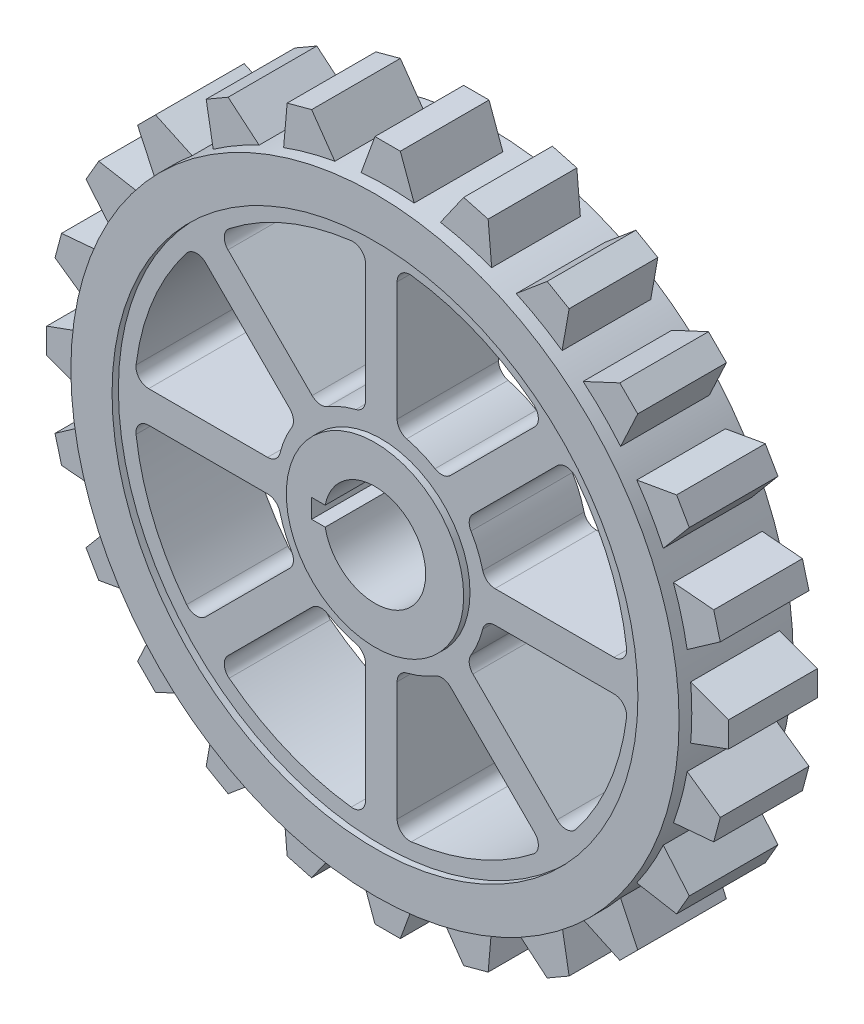
from build123d import *
from build123d.topology import SkipClean

# Parameters (mm, degrees)
SKETCH2_R           = 41.5
BOSS_EXTRUDE2_DEPTH = 18
BOSS_EXTRUDE3_START = 9
SKETCH4_R           = 41.5
BOSS_EXTRUDE3_DEPTH = 8
SKETCH5_R           = 14
BOSS_EXTRUDE4_DEPTH = 18
CUT_EXTRUDE2_START  = 16
CUT_EXTRUDE2_DEPTH  = 2
CUT_EXTRUDE3_DEPTH  = 2
CUT_EXTRUDE4_DEPTH  = 18
CUT_EXTRUDE5_DEPTH  = 18


with BuildPart() as part:
    # Sketch2 → Boss-Extrude2 (new body)
    with BuildSketch(Plane(origin=(0, 0, 0), x_dir=(0, 1, 0), z_dir=(0, 0, 1))):
        with BuildLine():
            Line((-4.183821406, 47.817315258), (-2, 53.817315258))
            Line((-2, 53.817315258), (2, 53.817315258))
            Line((2, 53.817315258), (4.183821406, 47.817315258))
            ThreePointArc((4.183821406, 47.817315258), (6.265257227, 47.589353346), (8.334770726, 47.270832412))
            Line((8.334770726, 47.270832412), (11.997094492, 52.501172799))
            Line((11.997094492, 52.501172799), (15.860797798, 51.465896619))
            Line((15.860797798, 51.465896619), (16.417293023, 45.10512709))
            ThreePointArc((16.417293023, 45.10512709), (18.368804754, 44.346217561), (20.285362007, 43.502920457))
            Line((20.285362007, 43.502920457), (25.176606821, 47.607162177))
            Line((25.176606821, 47.607162177), (28.640708436, 45.607162177))
            Line((28.640708436, 45.607162177), (27.531953251, 39.319099051))
            ThreePointArc((27.531953251, 39.319099051), (29.220548592, 38.080960334), (30.85353939, 36.770356364))
            Line((30.85353939, 36.770356364), (36.640375002, 39.468802126))
            Line((36.640375002, 39.468802126), (39.468802126, 36.640375002))
            Line((39.468802126, 36.640375002), (36.770356364, 30.85353939))
            ThreePointArc((36.770356364, 30.85353939), (38.080960334, 29.220548592), (39.319099051, 27.531953251))
            Line((39.319099051, 27.531953251), (45.607162177, 28.640708436))
            Line((45.607162177, 28.640708436), (47.607162177, 25.176606821))
            Line((47.607162177, 25.176606821), (43.502920457, 20.285362007))
            ThreePointArc((43.502920457, 20.285362007), (44.346217561, 18.368804754), (45.10512709, 16.417293023))
            Line((45.10512709, 16.417293023), (51.465896619, 15.860797798))
            Line((51.465896619, 15.860797798), (52.501172799, 11.997094492))
            Line((52.501172799, 11.997094492), (47.270832412, 8.334770726))
            ThreePointArc((47.270832412, 8.334770726), (47.589353346, 6.265257227), (47.817315258, 4.183821406))
            Line((47.817315258, 4.183821406), (53.817315258, 2))
            Line((53.817315258, 2), (53.817315258, -2))
            Line((53.817315258, -2), (47.817315258, -4.183821406))
            ThreePointArc((47.817315258, -4.183821406), (47.589353346, -6.265257227), (47.270832412, -8.334770726))
            Line((47.270832412, -8.334770726), (52.501172799, -11.997094492))
            Line((52.501172799, -11.997094492), (51.465896619, -15.860797798))
            Line((51.465896619, -15.860797798), (45.10512709, -16.417293023))
            ThreePointArc((45.10512709, -16.417293023), (44.346217561, -18.368804754), (43.502920457, -20.285362007))
            Line((43.502920457, -20.285362007), (47.607162177, -25.176606821))
            Line((47.607162177, -25.176606821), (45.607162177, -28.640708436))
            Line((45.607162177, -28.640708436), (39.319099051, -27.531953251))
            ThreePointArc((39.319099051, -27.531953251), (38.080960334, -29.220548592), (36.770356364, -30.85353939))
            Line((36.770356364, -30.85353939), (39.468802126, -36.640375002))
            Line((39.468802126, -36.640375002), (36.640375002, -39.468802126))
            Line((36.640375002, -39.468802126), (30.85353939, -36.770356364))
            ThreePointArc((30.85353939, -36.770356364), (29.220548592, -38.080960334), (27.531953251, -39.319099051))
            Line((27.531953251, -39.319099051), (28.640708436, -45.607162177))
            Line((28.640708436, -45.607162177), (25.176606821, -47.607162177))
            Line((25.176606821, -47.607162177), (20.285362007, -43.502920457))
            ThreePointArc((20.285362007, -43.502920457), (18.368804754, -44.346217561), (16.417293023, -45.10512709))
            Line((16.417293023, -45.10512709), (15.860797798, -51.465896619))
            Line((15.860797798, -51.465896619), (11.997094492, -52.501172799))
            Line((11.997094492, -52.501172799), (8.334770726, -47.270832412))
            ThreePointArc((8.334770726, -47.270832412), (6.265257227, -47.589353346), (4.183821406, -47.817315258))
            Line((4.183821406, -47.817315258), (2, -53.817315258))
            Line((2, -53.817315258), (-2, -53.817315258))
            Line((-2, -53.817315258), (-4.183821406, -47.817315258))
            ThreePointArc((-4.183821406, -47.817315258), (-6.265257227, -47.589353346), (-8.334770726, -47.270832412))
            Line((-8.334770726, -47.270832412), (-11.997094492, -52.501172799))
            Line((-11.997094492, -52.501172799), (-15.860797798, -51.465896619))
            Line((-15.860797798, -51.465896619), (-16.417293023, -45.10512709))
            ThreePointArc((-16.417293023, -45.10512709), (-18.368804754, -44.346217561), (-20.285362007, -43.502920457))
            Line((-20.285362007, -43.502920457), (-25.176606821, -47.607162177))
            Line((-25.176606821, -47.607162177), (-28.640708436, -45.607162177))
            Line((-28.640708436, -45.607162177), (-27.531953251, -39.319099051))
            ThreePointArc((-27.531953251, -39.319099051), (-29.220548592, -38.080960334), (-30.85353939, -36.770356364))
            Line((-30.85353939, -36.770356364), (-36.640375002, -39.468802126))
            Line((-36.640375002, -39.468802126), (-39.468802126, -36.640375002))
            Line((-39.468802126, -36.640375002), (-36.770356364, -30.85353939))
            ThreePointArc((-36.770356364, -30.85353939), (-38.080960334, -29.220548592), (-39.319099051, -27.531953251))
            Line((-39.319099051, -27.531953251), (-45.607162177, -28.640708436))
            Line((-45.607162177, -28.640708436), (-47.607162177, -25.176606821))
            Line((-47.607162177, -25.176606821), (-43.502920457, -20.285362007))
            ThreePointArc((-43.502920457, -20.285362007), (-44.346217561, -18.368804754), (-45.10512709, -16.417293023))
            Line((-45.10512709, -16.417293023), (-51.465896619, -15.860797798))
            Line((-51.465896619, -15.860797798), (-52.501172799, -11.997094492))
            Line((-52.501172799, -11.997094492), (-47.270832412, -8.334770726))
            ThreePointArc((-47.270832412, -8.334770726), (-47.589353346, -6.265257227), (-47.817315258, -4.183821406))
            Line((-47.817315258, -4.183821406), (-53.817315258, -2))
            Line((-53.817315258, -2), (-53.817315258, 2))
            Line((-53.817315258, 2), (-47.817315258, 4.183821406))
            ThreePointArc((-47.817315258, 4.183821406), (-47.589353346, 6.265257227), (-47.270832412, 8.334770726))
            Line((-47.270832412, 8.334770726), (-52.501172799, 11.997094492))
            Line((-52.501172799, 11.997094492), (-51.465896619, 15.860797798))
            Line((-51.465896619, 15.860797798), (-45.10512709, 16.417293023))
            ThreePointArc((-45.10512709, 16.417293023), (-44.346217561, 18.368804754), (-43.502920457, 20.285362007))
            Line((-43.502920457, 20.285362007), (-47.607162177, 25.176606821))
            Line((-47.607162177, 25.176606821), (-45.607162177, 28.640708436))
            Line((-45.607162177, 28.640708436), (-39.319099051, 27.531953251))
            ThreePointArc((-39.319099051, 27.531953251), (-38.080960334, 29.220548592), (-36.770356364, 30.85353939))
            Line((-36.770356364, 30.85353939), (-39.468802126, 36.640375002))
            Line((-39.468802126, 36.640375002), (-36.640375002, 39.468802126))
            Line((-36.640375002, 39.468802126), (-30.85353939, 36.770356364))
            ThreePointArc((-30.85353939, 36.770356364), (-29.220548592, 38.080960334), (-27.531953251, 39.319099051))
            Line((-27.531953251, 39.319099051), (-28.640708436, 45.607162177))
            Line((-28.640708436, 45.607162177), (-25.176606821, 47.607162177))
            Line((-25.176606821, 47.607162177), (-20.285362007, 43.502920457))
            ThreePointArc((-20.285362007, 43.502920457), (-18.368804754, 44.346217561), (-16.417293023, 45.10512709))
            Line((-16.417293023, 45.10512709), (-15.860797798, 51.465896619))
            Line((-15.860797798, 51.465896619), (-11.997094492, 52.501172799))
            Line((-11.997094492, 52.501172799), (-8.334770726, 47.270832412))
            ThreePointArc((-8.334770726, 47.270832412), (-6.265257227, 47.589353346), (-4.183821406, 47.817315258))
        make_face()
        with Locations(Location((0, 0, 0), (0, 0, 270))):
            Circle(SKETCH2_R, mode=Mode.SUBTRACT)
    extrude(amount=BOSS_EXTRUDE2_DEPTH)

    # Sketch4 → Boss-Extrude3 (add, symmetric)
    with BuildSketch(Plane(origin=(0, 0, 0), x_dir=(0, 1, 0), z_dir=(0, 0, 1)).offset(BOSS_EXTRUDE3_START)):
        with Locations(Location((0, 0, 0), (0, 0, 270))):
            Circle(SKETCH4_R)
    extrude(amount=BOSS_EXTRUDE3_DEPTH, both=True)

    # Sketch5 → Boss-Extrude4 (add)
    with BuildSketch(Plane(origin=(0, 0, 0), x_dir=(0, 1, 0), z_dir=(0, 0, 1))):
        with Locations(Location((0, 0, 0), (0, 0, 270))):
            Circle(SKETCH5_R)
    extrude(amount=BOSS_EXTRUDE4_DEPTH)

    # Sketch6 → Cut-Extrude2 (cut)
    with SkipClean():  # the faces are left unmerged after this step: merging them gives an invalid solid
        with BuildSketch(Plane(origin=(0, 0, 0), x_dir=(0, 1, 0), z_dir=(0, 0, 1)).offset(CUT_EXTRUDE2_START)):
            with BuildLine():
                Line((-4.183821406, 47.817315258), (-2, 53.817315258))
                Line((-2, 53.817315258), (2, 53.817315258))
                Line((2, 53.817315258), (4.183821406, 47.817315258))
                ThreePointArc((4.183821406, 47.817315258), (0, 48), (-4.183821406, 47.817315258))
            make_face()
            with BuildLine():
                Line((8.334770726, 47.270832412), (11.997094492, 52.501172799))
                Line((11.997094492, 52.501172799), (15.860797798, 51.465896619))
                Line((15.860797798, 51.465896619), (16.417293023, 45.10512709))
                ThreePointArc((16.417293023, 45.10512709), (12.423314165, 46.364439662), (8.334770726, 47.270832412))
            make_face()
            with BuildLine():
                Line((20.285362007, 43.502920457), (25.176606821, 47.607162177))
                Line((25.176606821, 47.607162177), (28.640708436, 45.607162177))
                Line((28.640708436, 45.607162177), (27.531953251, 39.319099051))
                ThreePointArc((27.531953251, 39.319099051), (24, 41.569219382), (20.285362007, 43.502920457))
            make_face()
            with BuildLine():
                Line((30.85353939, 36.770356364), (36.640375002, 39.468802126))
                Line((36.640375002, 39.468802126), (39.468802126, 36.640375002))
                Line((39.468802126, 36.640375002), (36.770356364, 30.85353939))
                ThreePointArc((36.770356364, 30.85353939), (33.941125497, 33.941125497), (30.85353939, 36.770356364))
            make_face()
            with BuildLine():
                Line((39.319099051, 27.531953251), (45.607162177, 28.640708436))
                Line((45.607162177, 28.640708436), (47.607162177, 25.176606821))
                Line((47.607162177, 25.176606821), (43.502920457, 20.285362007))
                ThreePointArc((43.502920457, 20.285362007), (41.569219382, 24), (39.319099051, 27.531953251))
            make_face()
            with BuildLine():
                Line((45.10512709, 16.417293023), (51.465896619, 15.860797798))
                Line((51.465896619, 15.860797798), (52.501172799, 11.997094492))
                Line((52.501172799, 11.997094492), (47.270832412, 8.334770726))
                ThreePointArc((47.270832412, 8.334770726), (46.364439662, 12.423314165), (45.10512709, 16.417293023))
            make_face()
            with BuildLine():
                Line((47.817315258, 4.183821406), (53.817315258, 2))
                Line((53.817315258, 2), (53.817315258, -2))
                Line((53.817315258, -2), (47.817315258, -4.183821406))
                ThreePointArc((47.817315258, -4.183821406), (48, 0), (47.817315258, 4.183821406))
            make_face()
            with BuildLine():
                Line((47.270832412, -8.334770726), (52.501172799, -11.997094492))
                Line((52.501172799, -11.997094492), (51.465896619, -15.860797798))
                Line((51.465896619, -15.860797798), (45.10512709, -16.417293023))
                ThreePointArc((45.10512709, -16.417293023), (46.364439662, -12.423314165), (47.270832412, -8.334770726))
            make_face()
            with BuildLine():
                Line((43.502920457, -20.285362007), (47.607162177, -25.176606821))
                Line((47.607162177, -25.176606821), (45.607162177, -28.640708436))
                Line((45.607162177, -28.640708436), (39.319099051, -27.531953251))
                ThreePointArc((39.319099051, -27.531953251), (41.569219382, -24), (43.502920457, -20.285362007))
            make_face()
            with BuildLine():
                Line((36.770356364, -30.85353939), (39.468802126, -36.640375002))
                Line((39.468802126, -36.640375002), (36.640375002, -39.468802126))
                Line((36.640375002, -39.468802126), (30.85353939, -36.770356364))
                ThreePointArc((30.85353939, -36.770356364), (33.941125497, -33.941125497), (36.770356364, -30.85353939))
            make_face()
            with BuildLine():
                Line((27.531953251, -39.319099051), (28.640708436, -45.607162177))
                Line((28.640708436, -45.607162177), (25.176606821, -47.607162177))
                Line((25.176606821, -47.607162177), (20.285362007, -43.502920457))
                ThreePointArc((20.285362007, -43.502920457), (24, -41.569219382), (27.531953251, -39.319099051))
            make_face()
            with BuildLine():
                Line((16.417293023, -45.10512709), (15.860797798, -51.465896619))
                Line((15.860797798, -51.465896619), (11.997094492, -52.501172799))
                Line((11.997094492, -52.501172799), (8.334770726, -47.270832412))
                ThreePointArc((8.334770726, -47.270832412), (12.423314165, -46.364439662), (16.417293023, -45.10512709))
            make_face()
            with BuildLine():
                Line((4.183821406, -47.817315258), (2, -53.817315258))
                Line((2, -53.817315258), (-2, -53.817315258))
                Line((-2, -53.817315258), (-4.183821406, -47.817315258))
                ThreePointArc((-4.183821406, -47.817315258), (0, -48), (4.183821406, -47.817315258))
            make_face()
            with BuildLine():
                Line((-8.334770726, -47.270832412), (-11.997094492, -52.501172799))
                Line((-11.997094492, -52.501172799), (-15.860797798, -51.465896619))
                Line((-15.860797798, -51.465896619), (-16.417293023, -45.10512709))
                ThreePointArc((-16.417293023, -45.10512709), (-12.423314165, -46.364439662), (-8.334770726, -47.270832412))
            make_face()
            with BuildLine():
                Line((-20.285362007, -43.502920457), (-25.176606821, -47.607162177))
                Line((-25.176606821, -47.607162177), (-28.640708436, -45.607162177))
                Line((-28.640708436, -45.607162177), (-27.531953251, -39.319099051))
                ThreePointArc((-27.531953251, -39.319099051), (-24, -41.569219382), (-20.285362007, -43.502920457))
            make_face()
            with BuildLine():
                Line((-30.85353939, -36.770356364), (-36.640375002, -39.468802126))
                Line((-36.640375002, -39.468802126), (-39.468802126, -36.640375002))
                Line((-39.468802126, -36.640375002), (-36.770356364, -30.85353939))
                ThreePointArc((-36.770356364, -30.85353939), (-33.941125497, -33.941125497), (-30.85353939, -36.770356364))
            make_face()
            with BuildLine():
                Line((-39.319099051, -27.531953251), (-45.607162177, -28.640708436))
                Line((-45.607162177, -28.640708436), (-47.607162177, -25.176606821))
                Line((-47.607162177, -25.176606821), (-43.502920457, -20.285362007))
                ThreePointArc((-43.502920457, -20.285362007), (-41.569219382, -24), (-39.319099051, -27.531953251))
            make_face()
            with BuildLine():
                Line((-45.10512709, -16.417293023), (-51.465896619, -15.860797798))
                Line((-51.465896619, -15.860797798), (-52.501172799, -11.997094492))
                Line((-52.501172799, -11.997094492), (-47.270832412, -8.334770726))
                ThreePointArc((-47.270832412, -8.334770726), (-46.364439662, -12.423314165), (-45.10512709, -16.417293023))
            make_face()
            with BuildLine():
                Line((-47.817315258, -4.183821406), (-53.817315258, -2))
                Line((-53.817315258, -2), (-53.817315258, 2))
                Line((-53.817315258, 2), (-47.817315258, 4.183821406))
                ThreePointArc((-47.817315258, 4.183821406), (-48, 0), (-47.817315258, -4.183821406))
            make_face()
            with BuildLine():
                Line((-47.270832412, 8.334770726), (-52.501172799, 11.997094492))
                Line((-52.501172799, 11.997094492), (-51.465896619, 15.860797798))
                Line((-51.465896619, 15.860797798), (-45.10512709, 16.417293023))
                ThreePointArc((-45.10512709, 16.417293023), (-46.364439662, 12.423314165), (-47.270832412, 8.334770726))
            make_face()
            with BuildLine():
                Line((-43.502920457, 20.285362007), (-47.607162177, 25.176606821))
                Line((-47.607162177, 25.176606821), (-45.607162177, 28.640708436))
                Line((-45.607162177, 28.640708436), (-39.319099051, 27.531953251))
                ThreePointArc((-39.319099051, 27.531953251), (-41.569219382, 24), (-43.502920457, 20.285362007))
            make_face()
            with BuildLine():
                Line((-36.770356364, 30.85353939), (-39.468802126, 36.640375002))
                Line((-39.468802126, 36.640375002), (-36.640375002, 39.468802126))
                Line((-36.640375002, 39.468802126), (-30.85353939, 36.770356364))
                ThreePointArc((-30.85353939, 36.770356364), (-33.941125497, 33.941125497), (-36.770356364, 30.85353939))
            make_face()
            with BuildLine():
                Line((-27.531953251, 39.319099051), (-28.640708436, 45.607162177))
                Line((-28.640708436, 45.607162177), (-25.176606821, 47.607162177))
                Line((-25.176606821, 47.607162177), (-20.285362007, 43.502920457))
                ThreePointArc((-20.285362007, 43.502920457), (-24, 41.569219382), (-27.531953251, 39.319099051))
            make_face()
            with BuildLine():
                Line((-16.417293023, 45.10512709), (-15.860797798, 51.465896619))
                Line((-15.860797798, 51.465896619), (-11.997094492, 52.501172799))
                Line((-11.997094492, 52.501172799), (-8.334770726, 47.270832412))
                ThreePointArc((-8.334770726, 47.270832412), (-12.423314165, 46.364439662), (-16.417293023, 45.10512709))
            make_face()
        extrude(amount=CUT_EXTRUDE2_DEPTH, mode=Mode.SUBTRACT)

    # Sketch6<2> → Cut-Extrude3 (cut)
    with SkipClean():  # the faces are left unmerged after this step: merging them gives an invalid solid
        with BuildSketch(Plane(origin=(0, 0, 0), x_dir=(0, 1, 0), z_dir=(0, 0, 1))):
            with BuildLine():
                Line((-4.183821406, 47.817315258), (-2, 53.817315258))
                Line((-2, 53.817315258), (2, 53.817315258))
                Line((2, 53.817315258), (4.183821406, 47.817315258))
                ThreePointArc((4.183821406, 47.817315258), (0, 48), (-4.183821406, 47.817315258))
            make_face()
            with BuildLine():
                Line((8.334770726, 47.270832412), (11.997094492, 52.501172799))
                Line((11.997094492, 52.501172799), (15.860797798, 51.465896619))
                Line((15.860797798, 51.465896619), (16.417293023, 45.10512709))
                ThreePointArc((16.417293023, 45.10512709), (12.423314165, 46.364439662), (8.334770726, 47.270832412))
            make_face()
            with BuildLine():
                Line((20.285362007, 43.502920457), (25.176606821, 47.607162177))
                Line((25.176606821, 47.607162177), (28.640708436, 45.607162177))
                Line((28.640708436, 45.607162177), (27.531953251, 39.319099051))
                ThreePointArc((27.531953251, 39.319099051), (24, 41.569219382), (20.285362007, 43.502920457))
            make_face()
            with BuildLine():
                Line((30.85353939, 36.770356364), (36.640375002, 39.468802126))
                Line((36.640375002, 39.468802126), (39.468802126, 36.640375002))
                Line((39.468802126, 36.640375002), (36.770356364, 30.85353939))
                ThreePointArc((36.770356364, 30.85353939), (33.941125497, 33.941125497), (30.85353939, 36.770356364))
            make_face()
            with BuildLine():
                Line((39.319099051, 27.531953251), (45.607162177, 28.640708436))
                Line((45.607162177, 28.640708436), (47.607162177, 25.176606821))
                Line((47.607162177, 25.176606821), (43.502920457, 20.285362007))
                ThreePointArc((43.502920457, 20.285362007), (41.569219382, 24), (39.319099051, 27.531953251))
            make_face()
            with BuildLine():
                Line((45.10512709, 16.417293023), (51.465896619, 15.860797798))
                Line((51.465896619, 15.860797798), (52.501172799, 11.997094492))
                Line((52.501172799, 11.997094492), (47.270832412, 8.334770726))
                ThreePointArc((47.270832412, 8.334770726), (46.364439662, 12.423314165), (45.10512709, 16.417293023))
            make_face()
            with BuildLine():
                Line((47.817315258, 4.183821406), (53.817315258, 2))
                Line((53.817315258, 2), (53.817315258, -2))
                Line((53.817315258, -2), (47.817315258, -4.183821406))
                ThreePointArc((47.817315258, -4.183821406), (48, 0), (47.817315258, 4.183821406))
            make_face()
            with BuildLine():
                Line((47.270832412, -8.334770726), (52.501172799, -11.997094492))
                Line((52.501172799, -11.997094492), (51.465896619, -15.860797798))
                Line((51.465896619, -15.860797798), (45.10512709, -16.417293023))
                ThreePointArc((45.10512709, -16.417293023), (46.364439662, -12.423314165), (47.270832412, -8.334770726))
            make_face()
            with BuildLine():
                Line((43.502920457, -20.285362007), (47.607162177, -25.176606821))
                Line((47.607162177, -25.176606821), (45.607162177, -28.640708436))
                Line((45.607162177, -28.640708436), (39.319099051, -27.531953251))
                ThreePointArc((39.319099051, -27.531953251), (41.569219382, -24), (43.502920457, -20.285362007))
            make_face()
            with BuildLine():
                Line((36.770356364, -30.85353939), (39.468802126, -36.640375002))
                Line((39.468802126, -36.640375002), (36.640375002, -39.468802126))
                Line((36.640375002, -39.468802126), (30.85353939, -36.770356364))
                ThreePointArc((30.85353939, -36.770356364), (33.941125497, -33.941125497), (36.770356364, -30.85353939))
            make_face()
            with BuildLine():
                Line((27.531953251, -39.319099051), (28.640708436, -45.607162177))
                Line((28.640708436, -45.607162177), (25.176606821, -47.607162177))
                Line((25.176606821, -47.607162177), (20.285362007, -43.502920457))
                ThreePointArc((20.285362007, -43.502920457), (24, -41.569219382), (27.531953251, -39.319099051))
            make_face()
            with BuildLine():
                Line((16.417293023, -45.10512709), (15.860797798, -51.465896619))
                Line((15.860797798, -51.465896619), (11.997094492, -52.501172799))
                Line((11.997094492, -52.501172799), (8.334770726, -47.270832412))
                ThreePointArc((8.334770726, -47.270832412), (12.423314165, -46.364439662), (16.417293023, -45.10512709))
            make_face()
            with BuildLine():
                Line((4.183821406, -47.817315258), (2, -53.817315258))
                Line((2, -53.817315258), (-2, -53.817315258))
                Line((-2, -53.817315258), (-4.183821406, -47.817315258))
                ThreePointArc((-4.183821406, -47.817315258), (0, -48), (4.183821406, -47.817315258))
            make_face()
            with BuildLine():
                Line((-8.334770726, -47.270832412), (-11.997094492, -52.501172799))
                Line((-11.997094492, -52.501172799), (-15.860797798, -51.465896619))
                Line((-15.860797798, -51.465896619), (-16.417293023, -45.10512709))
                ThreePointArc((-16.417293023, -45.10512709), (-12.423314165, -46.364439662), (-8.334770726, -47.270832412))
            make_face()
            with BuildLine():
                Line((-20.285362007, -43.502920457), (-25.176606821, -47.607162177))
                Line((-25.176606821, -47.607162177), (-28.640708436, -45.607162177))
                Line((-28.640708436, -45.607162177), (-27.531953251, -39.319099051))
                ThreePointArc((-27.531953251, -39.319099051), (-24, -41.569219382), (-20.285362007, -43.502920457))
            make_face()
            with BuildLine():
                Line((-30.85353939, -36.770356364), (-36.640375002, -39.468802126))
                Line((-36.640375002, -39.468802126), (-39.468802126, -36.640375002))
                Line((-39.468802126, -36.640375002), (-36.770356364, -30.85353939))
                ThreePointArc((-36.770356364, -30.85353939), (-33.941125497, -33.941125497), (-30.85353939, -36.770356364))
            make_face()
            with BuildLine():
                Line((-39.319099051, -27.531953251), (-45.607162177, -28.640708436))
                Line((-45.607162177, -28.640708436), (-47.607162177, -25.176606821))
                Line((-47.607162177, -25.176606821), (-43.502920457, -20.285362007))
                ThreePointArc((-43.502920457, -20.285362007), (-41.569219382, -24), (-39.319099051, -27.531953251))
            make_face()
            with BuildLine():
                Line((-45.10512709, -16.417293023), (-51.465896619, -15.860797798))
                Line((-51.465896619, -15.860797798), (-52.501172799, -11.997094492))
                Line((-52.501172799, -11.997094492), (-47.270832412, -8.334770726))
                ThreePointArc((-47.270832412, -8.334770726), (-46.364439662, -12.423314165), (-45.10512709, -16.417293023))
            make_face()
            with BuildLine():
                Line((-47.817315258, -4.183821406), (-53.817315258, -2))
                Line((-53.817315258, -2), (-53.817315258, 2))
                Line((-53.817315258, 2), (-47.817315258, 4.183821406))
                ThreePointArc((-47.817315258, 4.183821406), (-48, 0), (-47.817315258, -4.183821406))
            make_face()
            with BuildLine():
                Line((-47.270832412, 8.334770726), (-52.501172799, 11.997094492))
                Line((-52.501172799, 11.997094492), (-51.465896619, 15.860797798))
                Line((-51.465896619, 15.860797798), (-45.10512709, 16.417293023))
                ThreePointArc((-45.10512709, 16.417293023), (-46.364439662, 12.423314165), (-47.270832412, 8.334770726))
            make_face()
            with BuildLine():
                Line((-43.502920457, 20.285362007), (-47.607162177, 25.176606821))
                Line((-47.607162177, 25.176606821), (-45.607162177, 28.640708436))
                Line((-45.607162177, 28.640708436), (-39.319099051, 27.531953251))
                ThreePointArc((-39.319099051, 27.531953251), (-41.569219382, 24), (-43.502920457, 20.285362007))
            make_face()
            with BuildLine():
                Line((-36.770356364, 30.85353939), (-39.468802126, 36.640375002))
                Line((-39.468802126, 36.640375002), (-36.640375002, 39.468802126))
                Line((-36.640375002, 39.468802126), (-30.85353939, 36.770356364))
                ThreePointArc((-30.85353939, 36.770356364), (-33.941125497, 33.941125497), (-36.770356364, 30.85353939))
            make_face()
            with BuildLine():
                Line((-27.531953251, 39.319099051), (-28.640708436, 45.607162177))
                Line((-28.640708436, 45.607162177), (-25.176606821, 47.607162177))
                Line((-25.176606821, 47.607162177), (-20.285362007, 43.502920457))
                ThreePointArc((-20.285362007, 43.502920457), (-24, 41.569219382), (-27.531953251, 39.319099051))
            make_face()
            with BuildLine():
                Line((-16.417293023, 45.10512709), (-15.860797798, 51.465896619))
                Line((-15.860797798, 51.465896619), (-11.997094492, 52.501172799))
                Line((-11.997094492, 52.501172799), (-8.334770726, 47.270832412))
                ThreePointArc((-8.334770726, 47.270832412), (-12.423314165, 46.364439662), (-16.417293023, 45.10512709))
            make_face()
        extrude(amount=CUT_EXTRUDE3_DEPTH, mode=Mode.SUBTRACT)

    # Sketch7 → Cut-Extrude4 (cut)
    with SkipClean():  # the faces are left unmerged after this step: merging them gives an invalid solid
        with BuildSketch(Plane(origin=(0, 0, 0), x_dir=(0, 1, 0), z_dir=(0, 0, 1))):
            with BuildLine():
                Line((-1.5, 7.858116823), (-1.5, 10))
                Line((-1.5, 10), (1.5, 10))
                Line((1.5, 10), (1.5, 7.858116823))
                ThreePointArc((1.5, 7.858116823), (0, -8), (-1.5, 7.858116823))
            make_face()
        extrude(amount=CUT_EXTRUDE4_DEPTH, mode=Mode.SUBTRACT)

    # Sketch8 → Cut-Extrude5 (cut)
    with SkipClean():  # the faces are left unmerged after this step: merging them gives an invalid solid
        with BuildSketch(Plane(origin=(0, 0, 0), x_dir=(0, 1, 0), z_dir=(0, 0, 1))):
            with BuildLine():
                Line((2.5, 36.725331857), (2.5, 17.944358445))
                ThreePointArc((2.5, 17.944358445), (2.923140309, 16.714109074), (4.013513514, 16.004427802))
                ThreePointArc((4.013513514, 16.004427802), (6.314276634, 15.244012286), (8.478856806, 14.15482205))
                ThreePointArc((8.478856806, 14.15482205), (9.751687534, 13.885632203), (10.920810587, 14.456344493))
                Line((10.920810587, 14.456344493), (24.200964244, 27.73649815))
                ThreePointArc((24.200964244, 27.73649815), (24.7830355, 29.272559678), (24.018466935, 30.726425859))
                ThreePointArc((24.018466935, 30.726425859), (14.924653862, 36.031301768), (4.743243243, 38.71048493))
                ThreePointArc((4.743243243, 38.71048493), (3.174572991, 38.223077911), (2.5, 36.725331857))
            make_face()
            with BuildLine():
                Line((27.73649815, 24.200964244), (14.456344493, 10.920810587))
                ThreePointArc((14.456344493, 10.920810587), (13.885632203, 9.751687534), (14.15482205, 8.478856806))
                ThreePointArc((14.15482205, 8.478856806), (15.244012286, 6.314276634), (16.004427802, 4.013513514))
                ThreePointArc((16.004427802, 4.013513514), (16.714109074, 2.923140309), (17.944358445, 2.5))
                Line((17.944358445, 2.5), (36.725331857, 2.5))
                ThreePointArc((36.725331857, 2.5), (38.223077911, 3.174572991), (38.71048493, 4.743243243))
                ThreePointArc((38.71048493, 4.743243243), (36.031301768, 14.924653862), (30.726425859, 24.018466935))
                ThreePointArc((30.726425859, 24.018466935), (29.272559678, 24.7830355), (27.73649815, 24.200964244))
            make_face()
            with BuildLine():
                Line((36.725331857, -2.5), (17.944358445, -2.5))
                ThreePointArc((17.944358445, -2.5), (16.714109074, -2.923140309), (16.004427802, -4.013513514))
                ThreePointArc((16.004427802, -4.013513514), (15.244012286, -6.314276634), (14.15482205, -8.478856806))
                ThreePointArc((14.15482205, -8.478856806), (13.885632203, -9.751687534), (14.456344493, -10.920810587))
                Line((14.456344493, -10.920810587), (27.73649815, -24.200964244))
                ThreePointArc((27.73649815, -24.200964244), (29.272559678, -24.7830355), (30.726425859, -24.018466935))
                ThreePointArc((30.726425859, -24.018466935), (36.031301768, -14.924653862), (38.71048493, -4.743243243))
                ThreePointArc((38.71048493, -4.743243243), (38.223077911, -3.174572991), (36.725331857, -2.5))
            make_face()
            with BuildLine():
                Line((24.200964244, -27.73649815), (10.920810587, -14.456344493))
                ThreePointArc((10.920810587, -14.456344493), (9.751687534, -13.885632203), (8.478856806, -14.15482205))
                ThreePointArc((8.478856806, -14.15482205), (6.314276634, -15.244012286), (4.013513514, -16.004427802))
                ThreePointArc((4.013513514, -16.004427802), (2.923140309, -16.714109074), (2.5, -17.944358445))
                Line((2.5, -17.944358445), (2.5, -36.725331857))
                ThreePointArc((2.5, -36.725331857), (3.174572991, -38.223077911), (4.743243243, -38.71048493))
                ThreePointArc((4.743243243, -38.71048493), (14.924653862, -36.031301768), (24.018466935, -30.726425859))
                ThreePointArc((24.018466935, -30.726425859), (24.7830355, -29.272559678), (24.200964244, -27.73649815))
            make_face()
            with BuildLine():
                Line((-2.5, -36.725331857), (-2.5, -17.944358445))
                ThreePointArc((-2.5, -17.944358445), (-2.923140309, -16.714109074), (-4.013513514, -16.004427802))
                ThreePointArc((-4.013513514, -16.004427802), (-6.314276634, -15.244012286), (-8.478856806, -14.15482205))
                ThreePointArc((-8.478856806, -14.15482205), (-9.751687534, -13.885632203), (-10.920810587, -14.456344493))
                Line((-10.920810587, -14.456344493), (-24.200964244, -27.73649815))
                ThreePointArc((-24.200964244, -27.73649815), (-24.7830355, -29.272559678), (-24.018466935, -30.726425859))
                ThreePointArc((-24.018466935, -30.726425859), (-14.924653862, -36.031301768), (-4.743243243, -38.71048493))
                ThreePointArc((-4.743243243, -38.71048493), (-3.174572991, -38.223077911), (-2.5, -36.725331857))
            make_face()
            with BuildLine():
                Line((-27.73649815, -24.200964244), (-14.456344493, -10.920810587))
                ThreePointArc((-14.456344493, -10.920810587), (-13.885632203, -9.751687534), (-14.15482205, -8.478856806))
                ThreePointArc((-14.15482205, -8.478856806), (-15.244012286, -6.314276634), (-16.004427802, -4.013513514))
                ThreePointArc((-16.004427802, -4.013513514), (-16.714109074, -2.923140309), (-17.944358445, -2.5))
                Line((-17.944358445, -2.5), (-36.725331857, -2.5))
                ThreePointArc((-36.725331857, -2.5), (-38.223077911, -3.174572991), (-38.71048493, -4.743243243))
                ThreePointArc((-38.71048493, -4.743243243), (-36.031301768, -14.924653862), (-30.726425859, -24.018466935))
                ThreePointArc((-30.726425859, -24.018466935), (-29.272559678, -24.7830355), (-27.73649815, -24.200964244))
            make_face()
            with BuildLine():
                Line((-36.725331857, 2.5), (-17.944358445, 2.5))
                ThreePointArc((-17.944358445, 2.5), (-16.714109074, 2.923140309), (-16.004427802, 4.013513514))
                ThreePointArc((-16.004427802, 4.013513514), (-15.244012286, 6.314276634), (-14.15482205, 8.478856806))
                ThreePointArc((-14.15482205, 8.478856806), (-13.885632203, 9.751687534), (-14.456344493, 10.920810587))
                Line((-14.456344493, 10.920810587), (-27.73649815, 24.200964244))
                ThreePointArc((-27.73649815, 24.200964244), (-29.272559678, 24.7830355), (-30.726425859, 24.018466935))
                ThreePointArc((-30.726425859, 24.018466935), (-36.031301768, 14.924653862), (-38.71048493, 4.743243243))
                ThreePointArc((-38.71048493, 4.743243243), (-38.223077911, 3.174572991), (-36.725331857, 2.5))
            make_face()
            with BuildLine():
                Line((-24.200964244, 27.73649815), (-10.920810587, 14.456344493))
                ThreePointArc((-10.920810587, 14.456344493), (-9.751687534, 13.885632203), (-8.478856806, 14.15482205))
                ThreePointArc((-8.478856806, 14.15482205), (-6.314276634, 15.244012286), (-4.013513514, 16.004427802))
                ThreePointArc((-4.013513514, 16.004427802), (-2.923140309, 16.714109074), (-2.5, 17.944358445))
                Line((-2.5, 17.944358445), (-2.5, 36.725331857))
                ThreePointArc((-2.5, 36.725331857), (-3.174572991, 38.223077911), (-4.743243243, 38.71048493))
                ThreePointArc((-4.743243243, 38.71048493), (-14.924653862, 36.031301768), (-24.018466935, 30.726425859))
                ThreePointArc((-24.018466935, 30.726425859), (-24.7830355, 29.272559678), (-24.200964244, 27.73649815))
            make_face()
        extrude(amount=CUT_EXTRUDE5_DEPTH, mode=Mode.SUBTRACT)


solid = part.part
